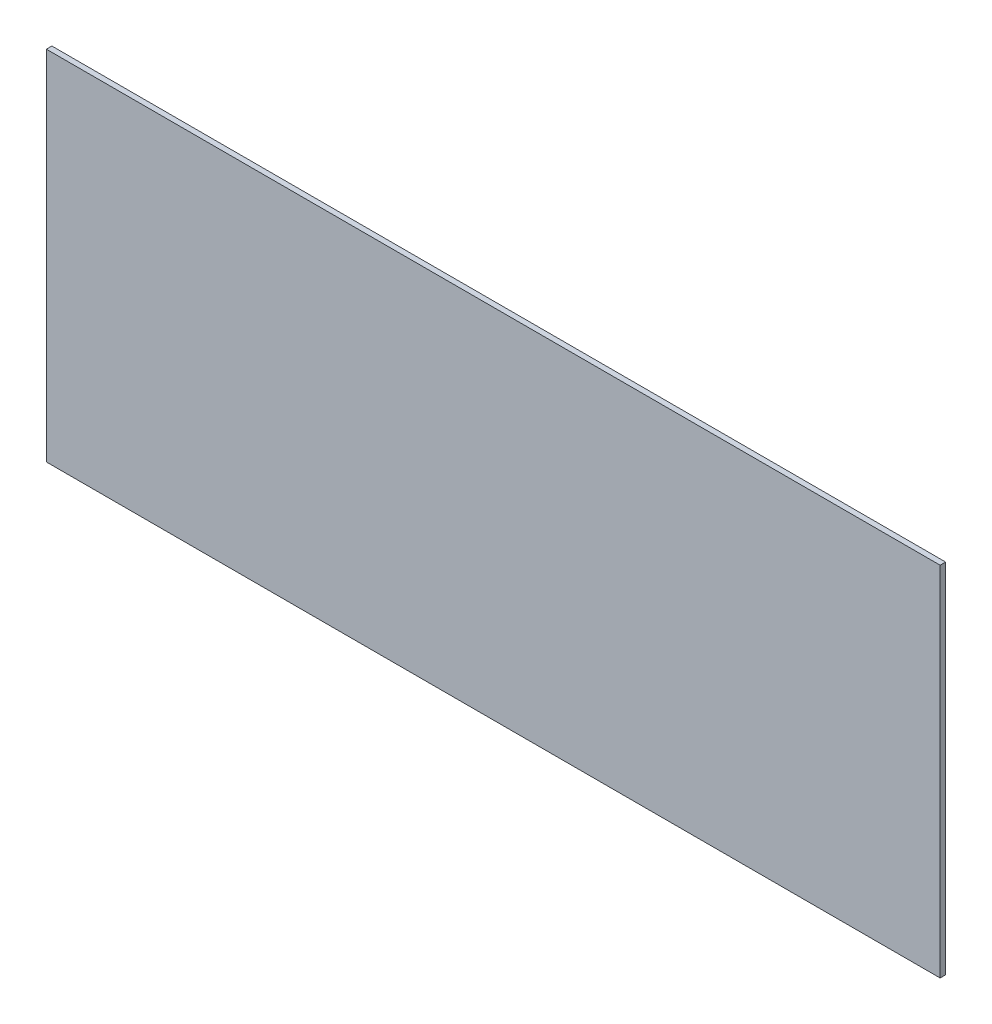
from build123d import *

# Parameters (mm, degrees)
SKETCH1_W           = 130
SKETCH1_H           = 52
BOSS_EXTRUDE1_DEPTH = 0.8


with BuildPart() as part:
    # Sketch1 → Boss-Extrude1 (new body)
    with BuildSketch(Plane.XY):
        with Locations((-53.208808224, -9.5)):
            Rectangle(SKETCH1_W, SKETCH1_H)
    extrude(amount=BOSS_EXTRUDE1_DEPTH)


solid = part.part
